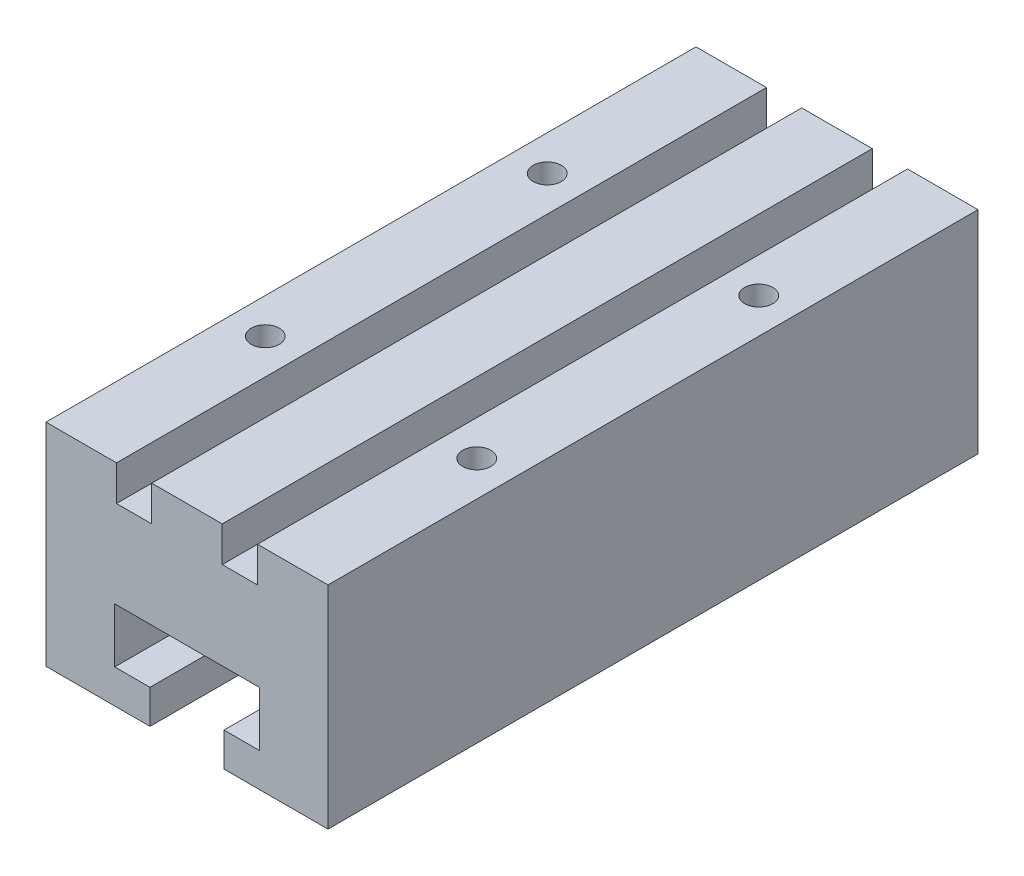
from build123d import *

# Parameters (mm, degrees)
CROQUIS1_W              = 40
CROQUIS1_H              = 30
SALIENTE_EXTRUIR1_DEPTH = 92.2
CORTAR_EXTRUIR1_DEPTH   = 96.529262532
CROQUIS3_W              = 5
CROQUIS3_H              = 92.2
CORTAR_EXTRUIR2_DEPTH   = 5
CROQUIS4_R              = 2
CORTAR_EXTRUIR3_DEPTH   = 10


with BuildPart() as part:
    # Croquis1 → Saliente-Extruir1 (new body)
    with BuildSketch(Plane.XY):
        Rectangle(CROQUIS1_W, CROQUIS1_H)
    extrude(amount=SALIENTE_EXTRUIR1_DEPTH)

    # Croquis2 → Cortar-Extruir1 (cut, through all)
    with BuildSketch(Plane.XY.offset(92.2)):
        Polygon((-10.25, -2.45), (-10.25, -10.2), (-5.25, -10.2), (-5.25, -15), (5.25, -15), (5.25, -10.2), (10.25, -10.2), (10.25, -2.45), align=None)
    extrude(amount=-CORTAR_EXTRUIR1_DEPTH, mode=Mode.SUBTRACT)

    # Croquis3 → Cortar-Extruir2 (cut)
    with BuildSketch(Plane(origin=(0, 15, 0), x_dir=(1, 0, 0), z_dir=(0, 1, 0))):
        with Locations((-7.5, -46.1)):
            Rectangle(CROQUIS3_W, CROQUIS3_H)
        with Locations((7.5, -46.1)):
            Rectangle(CROQUIS3_W, CROQUIS3_H)
    extrude(amount=-CORTAR_EXTRUIR2_DEPTH, mode=Mode.SUBTRACT)

    # Croquis4 → Cortar-Extruir3 (cut)
    with BuildSketch(Plane(origin=(0, 15, 0), x_dir=(1, 0, 0), z_dir=(0, 1, 0))):
        with Locations(Location((-15, -26.1, 0), (0, 0, 270))):
            Circle(CROQUIS4_R)
        with Locations(Location((-15, -66.1, 0), (0, 0, 270))):
            Circle(CROQUIS4_R)
        with Locations(Location((15, -66.1, 0), (0, 0, 90))):
            Circle(CROQUIS4_R)
        with Locations(Location((15, -26.1, 0), (0, 0, 90))):
            Circle(CROQUIS4_R)
    extrude(amount=-CORTAR_EXTRUIR3_DEPTH, mode=Mode.SUBTRACT)


solid = part.part
